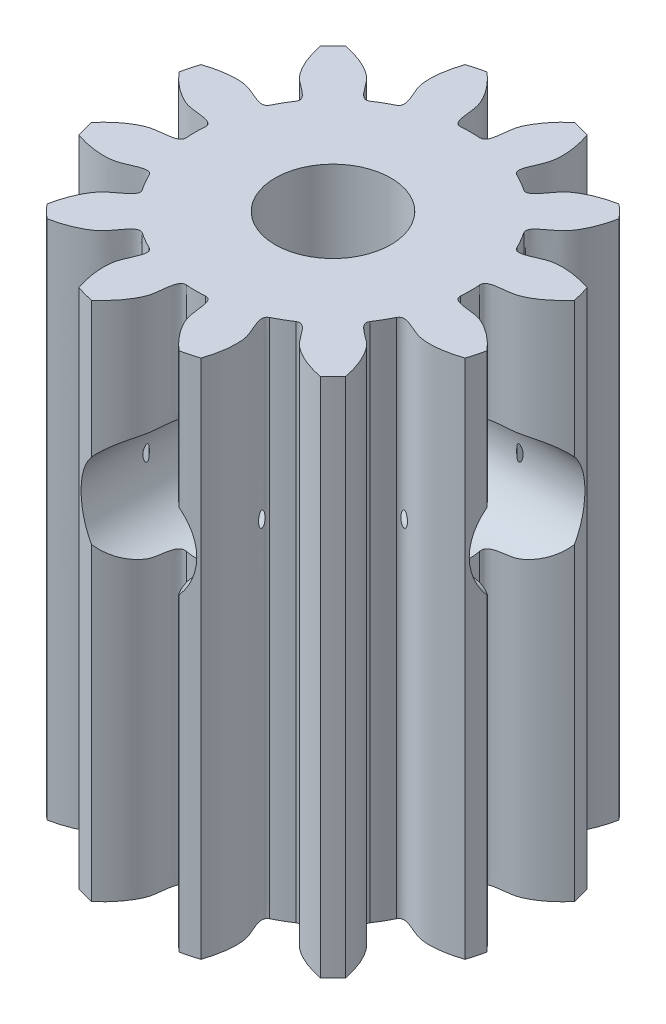
from build123d import *

# Parameters (mm, degrees)
PINION_TOOTH_BAND_18_MM_DEPTH           = 18
SHAFT_BORE_4_MM_THROUGH_SKETCH_R        = 2
SHAFT_BORE_4_MM_THROUGH_DEPTH           = 21.431317222
M4_SET_SCREW_HOLE_1_SIMPLIFIED_SKETCH_R = 2
M4_SET_SCREW_HOLE_1_SIMPLIFIED_DEPTH    = 8
M4_SET_SCREW_HOLE_2_SIMPLIFIED_SKETCH_R = 2
M4_SET_SCREW_HOLE_2_SIMPLIFIED_DEPTH    = 8


with BuildPart() as part:
    # 12T Module 1 Involute Profile → Pinion Tooth Band - 18 mm (new body)
    with BuildSketch(Plane(origin=(0, 0, 0), x_dir=(1, 0, 0), z_dir=(0, 1, 0))):
        with BuildLine():
            ThreePointArc((6.835156074, 1.510179277), (6.761480784, 1.811733316), (6.674508437, 2.109724418))
            add(Edge.make_bspline(
                [(4.26927172, 2.082262947), (4.28921203, 2.053331105), (4.328842346, 1.995830592), (4.442264933, 1.974875008), (4.561404521, 1.993783619), (4.695010451, 2.037395434), (4.836814767, 2.096319508), (4.981757663, 2.160318614), (5.123220173, 2.219161562), (5.228683275, 2.253704182), (5.29873853, 2.268577795), (5.337501067, 2.275661097), (5.381786176, 2.282324309), (5.431591999, 2.288266429), (5.486913645, 2.293141396), (5.54772681, 2.296617283), (5.613992975, 2.298358293), (5.685657797, 2.298031222), (5.762651652, 2.295304306), (5.844889548, 2.289848373), (5.932271293, 2.281337414), (6.024681452, 2.269448829), (6.121990094, 2.253865796), (6.224050512, 2.234270735), (6.330709274, 2.210374839), (6.44176677, 2.181802323), (6.557136435, 2.148557421), (6.634817322, 2.122856385), (6.674508437, 2.109724418)],
                knots=[0, 0, 0, 0, 0.040340589, 0.080174798, 0.128077722, 0.184595388, 0.246950417, 0.311283353, 0.373475922, 0.42966547, 0.443189042, 0.458849283, 0.476646191, 0.496579768, 0.518650013, 0.542856926, 0.569200507, 0.597680756, 0.628297674, 0.66105126, 0.695941513, 0.732968436, 0.772132026, 0.813432284, 0.856869211, 0.902442806, 0.950153069, 1, 1, 1, 1], degree=3))
            ThreePointArc((4.26927172, 2.082262947), (4.113620668, 2.375), (3.93792847, 2.656166291))
            add(Edge.make_bspline(
                [(3.93792847, 2.656166291), (3.922842914, 2.687901027), (3.892861167, 2.750972144), (3.931424393, 2.859676778), (4.007369524, 2.953400383), (4.111941429, 3.047300604), (4.233873332, 3.140644707), (4.361769631, 3.234169385), (4.483460374, 3.327258038), (4.566106712, 3.401320453), (4.614015266, 3.454553277), (4.639530854, 3.484580968), (4.66744392, 3.519601392), (4.697492858, 3.55976344), (4.729375526, 3.605235907), (4.762792315, 3.656163709), (4.797433156, 3.712681387), (4.832982315, 3.774908478), (4.869117664, 3.842950571), (4.905511636, 3.916898645), (4.941831802, 3.996828935), (4.977741064, 4.082802773), (5.012900083, 4.174866045), (5.046960472, 4.27305049), (5.079595399, 4.377367636), (5.110379623, 4.487832507), (5.139273525, 4.604368018), (5.155856219, 4.684492158), (5.16432916, 4.725431655)],
                knots=[0, 0, 0, 0, 0.040340589, 0.080174798, 0.128077722, 0.184595388, 0.246950417, 0.311283353, 0.373475922, 0.42966547, 0.443189042, 0.458849283, 0.476646191, 0.496579768, 0.518650013, 0.542856926, 0.569200507, 0.597680756, 0.628297674, 0.66105126, 0.695941513, 0.732968436, 0.772132026, 0.813432284, 0.856869211, 0.902442806, 0.950153069, 1, 1, 1, 1], degree=3))
            ThreePointArc((5.16432916, 4.725431655), (4.949747468, 4.949747468), (4.725431655, 5.16432916))
            add(Edge.make_bspline(
                [(2.656166291, 3.93792847), (2.687901027, 3.922842914), (2.750972144, 3.892861167), (2.859676778, 3.931424393), (2.953400383, 4.007369524), (3.047300604, 4.111941429), (3.140644707, 4.233873332), (3.234169385, 4.361769631), (3.327258038, 4.483460374), (3.401320453, 4.566106712), (3.454553277, 4.614015266), (3.484580968, 4.639530854), (3.519601392, 4.66744392), (3.55976344, 4.697492858), (3.605235907, 4.729375526), (3.656163709, 4.762792315), (3.712681387, 4.797433156), (3.774908478, 4.832982315), (3.842950571, 4.869117664), (3.916898645, 4.905511636), (3.996828935, 4.941831802), (4.082802773, 4.977741064), (4.174866045, 5.012900083), (4.27305049, 5.046960472), (4.377367636, 5.079595399), (4.487832507, 5.110379623), (4.604368018, 5.139273525), (4.684492158, 5.155856219), (4.725431655, 5.16432916)],
                knots=[0, 0, 0, 0, 0.040340589, 0.080174798, 0.128077722, 0.184595388, 0.246950417, 0.311283353, 0.373475922, 0.42966547, 0.443189042, 0.458849283, 0.476646191, 0.496579768, 0.518650013, 0.542856926, 0.569200507, 0.597680756, 0.628297674, 0.66105126, 0.695941513, 0.732968436, 0.772132026, 0.813432284, 0.856869211, 0.902442806, 0.950153069, 1, 1, 1, 1], degree=3))
            ThreePointArc((2.656166291, 3.93792847), (2.375, 4.113620668), (2.082262947, 4.26927172))
            add(Edge.make_bspline(
                [(2.082262947, 4.26927172), (2.053331105, 4.28921203), (1.995830592, 4.328842346), (1.974875008, 4.442264933), (1.993783619, 4.561404521), (2.037395434, 4.695010451), (2.096319508, 4.836814767), (2.160318614, 4.981757663), (2.219161562, 5.123220173), (2.253704182, 5.228683275), (2.268577795, 5.29873853), (2.275661097, 5.337501067), (2.282324309, 5.381786176), (2.288266429, 5.431591999), (2.293141396, 5.486913645), (2.296617283, 5.54772681), (2.298358293, 5.613992975), (2.298031222, 5.685657797), (2.295304306, 5.762651652), (2.289848373, 5.844889548), (2.281337414, 5.932271293), (2.269448829, 6.024681452), (2.253865796, 6.121990094), (2.234270735, 6.224050512), (2.210374839, 6.330709274), (2.181802323, 6.44176677), (2.148557421, 6.557136435), (2.122856385, 6.634817322), (2.109724418, 6.674508437)],
                knots=[0, 0, 0, 0, 0.040340589, 0.080174798, 0.128077722, 0.184595388, 0.246950417, 0.311283353, 0.373475922, 0.42966547, 0.443189042, 0.458849283, 0.476646191, 0.496579768, 0.518650013, 0.542856926, 0.569200507, 0.597680756, 0.628297674, 0.66105126, 0.695941513, 0.732968436, 0.772132026, 0.813432284, 0.856869211, 0.902442806, 0.950153069, 1, 1, 1, 1], degree=3))
            ThreePointArc((2.109724418, 6.674508437), (1.811733316, 6.761480784), (1.510179277, 6.835156074))
            add(Edge.make_bspline(
                [(0.33134325, 4.738429239), (0.366369115, 4.741232132), (0.435981178, 4.746802736), (0.51084054, 4.834551786), (0.554034997, 4.947184001), (0.583069022, 5.084696038), (0.602941435, 5.236964215), (0.619988031, 5.394487998), (0.639759798, 5.5464196), (0.662576563, 5.655024636), (0.684723264, 5.723131072), (0.697970213, 5.760242065), (0.714342257, 5.801925701), (0.734099142, 5.848029869), (0.757538119, 5.898377303), (0.784934495, 5.952780993), (0.816559819, 6.01103968), (0.852675481, 6.0729397), (0.893533988, 6.138254877), (0.939377913, 6.206747018), (0.990439492, 6.278166349), (1.046940388, 6.352251602), (1.109090011, 6.428731841), (1.17709004, 6.507321225), (1.251113875, 6.587742475), (1.331387147, 6.669634829), (1.41786291, 6.752925439), (1.478961103, 6.807348543), (1.510179277, 6.835156074)],
                knots=[0, 0, 0, 0, 0.040340589, 0.080174798, 0.128077722, 0.184595388, 0.246950417, 0.311283353, 0.373475922, 0.42966547, 0.443189042, 0.458849283, 0.476646191, 0.496579768, 0.518650013, 0.542856926, 0.569200507, 0.597680756, 0.628297674, 0.66105126, 0.695941513, 0.732968436, 0.772132026, 0.813432284, 0.856869211, 0.902442806, 0.950153069, 1, 1, 1, 1], degree=3))
            ThreePointArc((0.33134325, 4.738429239), (0, 4.75), (-0.33134325, 4.738429239))
            add(Edge.make_bspline(
                [(-0.33134325, 4.738429239), (-0.366369115, 4.741232132), (-0.435981178, 4.746802736), (-0.51084054, 4.834551786), (-0.554034997, 4.947184001), (-0.583069022, 5.084696038), (-0.602941435, 5.236964215), (-0.619988031, 5.394487998), (-0.639759798, 5.5464196), (-0.662576563, 5.655024636), (-0.684723264, 5.723131072), (-0.697970213, 5.760242065), (-0.714342257, 5.801925701), (-0.734099142, 5.848029869), (-0.757538119, 5.898377303), (-0.784934495, 5.952780993), (-0.816559819, 6.01103968), (-0.852675481, 6.0729397), (-0.893533988, 6.138254877), (-0.939377913, 6.206747018), (-0.990439492, 6.278166349), (-1.046940388, 6.352251602), (-1.109090011, 6.428731841), (-1.17709004, 6.507321225), (-1.251113875, 6.587742475), (-1.331387147, 6.669634829), (-1.41786291, 6.752925439), (-1.478961103, 6.807348543), (-1.510179277, 6.835156074)],
                knots=[0, 0, 0, 0, 0.040340589, 0.080174798, 0.128077722, 0.184595388, 0.246950417, 0.311283353, 0.373475922, 0.42966547, 0.443189042, 0.458849283, 0.476646191, 0.496579768, 0.518650013, 0.542856926, 0.569200507, 0.597680756, 0.628297674, 0.66105126, 0.695941513, 0.732968436, 0.772132026, 0.813432284, 0.856869211, 0.902442806, 0.950153069, 1, 1, 1, 1], degree=3))
            ThreePointArc((-1.510179277, 6.835156074), (-1.811733316, 6.761480784), (-2.109724418, 6.674508437))
            add(Edge.make_bspline(
                [(-2.082262947, 4.26927172), (-2.053331105, 4.28921203), (-1.995830592, 4.328842346), (-1.974875008, 4.442264933), (-1.993783619, 4.561404521), (-2.037395434, 4.695010451), (-2.096319508, 4.836814767), (-2.160318614, 4.981757663), (-2.219161562, 5.123220173), (-2.253704182, 5.228683275), (-2.268577795, 5.29873853), (-2.275661097, 5.337501067), (-2.282324309, 5.381786176), (-2.288266429, 5.431591999), (-2.293141396, 5.486913645), (-2.296617283, 5.54772681), (-2.298358293, 5.613992975), (-2.298031222, 5.685657797), (-2.295304306, 5.762651652), (-2.289848373, 5.844889548), (-2.281337414, 5.932271293), (-2.269448829, 6.024681452), (-2.253865796, 6.121990094), (-2.234270735, 6.224050512), (-2.210374839, 6.330709274), (-2.181802323, 6.44176677), (-2.148557421, 6.557136435), (-2.122856385, 6.634817322), (-2.109724418, 6.674508437)],
                knots=[0, 0, 0, 0, 0.040340589, 0.080174798, 0.128077722, 0.184595388, 0.246950417, 0.311283353, 0.373475922, 0.42966547, 0.443189042, 0.458849283, 0.476646191, 0.496579768, 0.518650013, 0.542856926, 0.569200507, 0.597680756, 0.628297674, 0.66105126, 0.695941513, 0.732968436, 0.772132026, 0.813432284, 0.856869211, 0.902442806, 0.950153069, 1, 1, 1, 1], degree=3))
            ThreePointArc((-2.082262947, 4.26927172), (-2.375, 4.113620668), (-2.656166291, 3.93792847))
            add(Edge.make_bspline(
                [(-2.656166291, 3.93792847), (-2.687901027, 3.922842914), (-2.750972144, 3.892861167), (-2.859676778, 3.931424393), (-2.953400383, 4.007369524), (-3.047300604, 4.111941429), (-3.140644707, 4.233873332), (-3.234169385, 4.361769631), (-3.327258038, 4.483460374), (-3.401320453, 4.566106712), (-3.454553277, 4.614015266), (-3.484580968, 4.639530854), (-3.519601392, 4.66744392), (-3.55976344, 4.697492858), (-3.605235907, 4.729375526), (-3.656163709, 4.762792315), (-3.712681387, 4.797433156), (-3.774908478, 4.832982315), (-3.842950571, 4.869117664), (-3.916898645, 4.905511636), (-3.996828935, 4.941831802), (-4.082802773, 4.977741064), (-4.174866045, 5.012900083), (-4.27305049, 5.046960472), (-4.377367636, 5.079595399), (-4.487832507, 5.110379623), (-4.604368018, 5.139273525), (-4.684492158, 5.155856219), (-4.725431655, 5.16432916)],
                knots=[0, 0, 0, 0, 0.040340589, 0.080174798, 0.128077722, 0.184595388, 0.246950417, 0.311283353, 0.373475922, 0.42966547, 0.443189042, 0.458849283, 0.476646191, 0.496579768, 0.518650013, 0.542856926, 0.569200507, 0.597680756, 0.628297674, 0.66105126, 0.695941513, 0.732968436, 0.772132026, 0.813432284, 0.856869211, 0.902442806, 0.950153069, 1, 1, 1, 1], degree=3))
            ThreePointArc((-4.725431655, 5.16432916), (-4.949747468, 4.949747468), (-5.16432916, 4.725431655))
            add(Edge.make_bspline(
                [(-3.93792847, 2.656166291), (-3.922842914, 2.687901027), (-3.892861167, 2.750972144), (-3.931424393, 2.859676778), (-4.007369524, 2.953400383), (-4.111941429, 3.047300604), (-4.233873332, 3.140644707), (-4.361769631, 3.234169385), (-4.483460374, 3.327258038), (-4.566106712, 3.401320453), (-4.614015266, 3.454553277), (-4.639530854, 3.484580968), (-4.66744392, 3.519601392), (-4.697492858, 3.55976344), (-4.729375526, 3.605235907), (-4.762792315, 3.656163709), (-4.797433156, 3.712681387), (-4.832982315, 3.774908478), (-4.869117664, 3.842950571), (-4.905511636, 3.916898645), (-4.941831802, 3.996828935), (-4.977741064, 4.082802773), (-5.012900083, 4.174866045), (-5.046960472, 4.27305049), (-5.079595399, 4.377367636), (-5.110379623, 4.487832507), (-5.139273525, 4.604368018), (-5.155856219, 4.684492158), (-5.16432916, 4.725431655)],
                knots=[0, 0, 0, 0, 0.040340589, 0.080174798, 0.128077722, 0.184595388, 0.246950417, 0.311283353, 0.373475922, 0.42966547, 0.443189042, 0.458849283, 0.476646191, 0.496579768, 0.518650013, 0.542856926, 0.569200507, 0.597680756, 0.628297674, 0.66105126, 0.695941513, 0.732968436, 0.772132026, 0.813432284, 0.856869211, 0.902442806, 0.950153069, 1, 1, 1, 1], degree=3))
            ThreePointArc((-3.93792847, 2.656166291), (-4.113620668, 2.375), (-4.26927172, 2.082262947))
            add(Edge.make_bspline(
                [(-4.26927172, 2.082262947), (-4.28921203, 2.053331105), (-4.328842346, 1.995830592), (-4.442264933, 1.974875008), (-4.561404521, 1.993783619), (-4.695010451, 2.037395434), (-4.836814767, 2.096319508), (-4.981757663, 2.160318614), (-5.123220173, 2.219161562), (-5.228683275, 2.253704182), (-5.29873853, 2.268577795), (-5.337501067, 2.275661097), (-5.381786176, 2.282324309), (-5.431591999, 2.288266429), (-5.486913645, 2.293141396), (-5.54772681, 2.296617283), (-5.613992975, 2.298358293), (-5.685657797, 2.298031222), (-5.762651652, 2.295304306), (-5.844889548, 2.289848373), (-5.932271293, 2.281337414), (-6.024681452, 2.269448829), (-6.121990094, 2.253865796), (-6.224050512, 2.234270735), (-6.330709274, 2.210374839), (-6.44176677, 2.181802323), (-6.557136435, 2.148557421), (-6.634817322, 2.122856385), (-6.674508437, 2.109724418)],
                knots=[0, 0, 0, 0, 0.040340589, 0.080174798, 0.128077722, 0.184595388, 0.246950417, 0.311283353, 0.373475922, 0.42966547, 0.443189042, 0.458849283, 0.476646191, 0.496579768, 0.518650013, 0.542856926, 0.569200507, 0.597680756, 0.628297674, 0.66105126, 0.695941513, 0.732968436, 0.772132026, 0.813432284, 0.856869211, 0.902442806, 0.950153069, 1, 1, 1, 1], degree=3))
            ThreePointArc((-6.674508437, 2.109724418), (-6.761480784, 1.811733316), (-6.835156074, 1.510179277))
            add(Edge.make_bspline(
                [(-4.738429239, 0.33134325), (-4.741232132, 0.366369115), (-4.746802736, 0.435981178), (-4.834551786, 0.51084054), (-4.947184001, 0.554034997), (-5.084696038, 0.583069022), (-5.236964215, 0.602941435), (-5.394487998, 0.619988031), (-5.5464196, 0.639759798), (-5.655024636, 0.662576563), (-5.723131072, 0.684723264), (-5.760242065, 0.697970213), (-5.801925701, 0.714342257), (-5.848029869, 0.734099142), (-5.898377303, 0.757538119), (-5.952780993, 0.784934495), (-6.01103968, 0.816559819), (-6.0729397, 0.852675481), (-6.138254877, 0.893533988), (-6.206747018, 0.939377913), (-6.278166349, 0.990439492), (-6.352251602, 1.046940388), (-6.428731841, 1.109090011), (-6.507321225, 1.17709004), (-6.587742475, 1.251113875), (-6.669634829, 1.331387147), (-6.752925439, 1.41786291), (-6.807348543, 1.478961103), (-6.835156074, 1.510179277)],
                knots=[0, 0, 0, 0, 0.040340589, 0.080174798, 0.128077722, 0.184595388, 0.246950417, 0.311283353, 0.373475922, 0.42966547, 0.443189042, 0.458849283, 0.476646191, 0.496579768, 0.518650013, 0.542856926, 0.569200507, 0.597680756, 0.628297674, 0.66105126, 0.695941513, 0.732968436, 0.772132026, 0.813432284, 0.856869211, 0.902442806, 0.950153069, 1, 1, 1, 1], degree=3))
            ThreePointArc((-4.738429239, 0.33134325), (-4.75, 0), (-4.738429239, -0.33134325))
            add(Edge.make_bspline(
                [(-4.738429239, -0.33134325), (-4.741232132, -0.366369115), (-4.746802736, -0.435981178), (-4.834551786, -0.51084054), (-4.947184001, -0.554034997), (-5.084696038, -0.583069022), (-5.236964215, -0.602941435), (-5.394487998, -0.619988031), (-5.5464196, -0.639759798), (-5.655024636, -0.662576563), (-5.723131072, -0.684723264), (-5.760242065, -0.697970213), (-5.801925701, -0.714342257), (-5.848029869, -0.734099142), (-5.898377303, -0.757538119), (-5.952780993, -0.784934495), (-6.01103968, -0.816559819), (-6.0729397, -0.852675481), (-6.138254877, -0.893533988), (-6.206747018, -0.939377913), (-6.278166349, -0.990439492), (-6.352251602, -1.046940388), (-6.428731841, -1.109090011), (-6.507321225, -1.17709004), (-6.587742475, -1.251113875), (-6.669634829, -1.331387147), (-6.752925439, -1.41786291), (-6.807348543, -1.478961103), (-6.835156074, -1.510179277)],
                knots=[0, 0, 0, 0, 0.040340589, 0.080174798, 0.128077722, 0.184595388, 0.246950417, 0.311283353, 0.373475922, 0.42966547, 0.443189042, 0.458849283, 0.476646191, 0.496579768, 0.518650013, 0.542856926, 0.569200507, 0.597680756, 0.628297674, 0.66105126, 0.695941513, 0.732968436, 0.772132026, 0.813432284, 0.856869211, 0.902442806, 0.950153069, 1, 1, 1, 1], degree=3))
            ThreePointArc((-6.835156074, -1.510179277), (-6.761480784, -1.811733316), (-6.674508437, -2.109724418))
            add(Edge.make_bspline(
                [(-4.26927172, -2.082262947), (-4.28921203, -2.053331105), (-4.328842346, -1.995830592), (-4.442264933, -1.974875008), (-4.561404521, -1.993783619), (-4.695010451, -2.037395434), (-4.836814767, -2.096319508), (-4.981757663, -2.160318614), (-5.123220173, -2.219161562), (-5.228683275, -2.253704182), (-5.29873853, -2.268577795), (-5.337501067, -2.275661097), (-5.381786176, -2.282324309), (-5.431591999, -2.288266429), (-5.486913645, -2.293141396), (-5.54772681, -2.296617283), (-5.613992975, -2.298358293), (-5.685657797, -2.298031222), (-5.762651652, -2.295304306), (-5.844889548, -2.289848373), (-5.932271293, -2.281337414), (-6.024681452, -2.269448829), (-6.121990094, -2.253865796), (-6.224050512, -2.234270735), (-6.330709274, -2.210374839), (-6.44176677, -2.181802323), (-6.557136435, -2.148557421), (-6.634817322, -2.122856385), (-6.674508437, -2.109724418)],
                knots=[0, 0, 0, 0, 0.040340589, 0.080174798, 0.128077722, 0.184595388, 0.246950417, 0.311283353, 0.373475922, 0.42966547, 0.443189042, 0.458849283, 0.476646191, 0.496579768, 0.518650013, 0.542856926, 0.569200507, 0.597680756, 0.628297674, 0.66105126, 0.695941513, 0.732968436, 0.772132026, 0.813432284, 0.856869211, 0.902442806, 0.950153069, 1, 1, 1, 1], degree=3))
            ThreePointArc((-4.26927172, -2.082262947), (-4.113620668, -2.375), (-3.93792847, -2.656166291))
            add(Edge.make_bspline(
                [(-3.93792847, -2.656166291), (-3.922842914, -2.687901027), (-3.892861167, -2.750972144), (-3.931424393, -2.859676778), (-4.007369524, -2.953400383), (-4.111941429, -3.047300604), (-4.233873332, -3.140644707), (-4.361769631, -3.234169385), (-4.483460374, -3.327258038), (-4.566106712, -3.401320453), (-4.614015266, -3.454553277), (-4.639530854, -3.484580968), (-4.66744392, -3.519601392), (-4.697492858, -3.55976344), (-4.729375526, -3.605235907), (-4.762792315, -3.656163709), (-4.797433156, -3.712681387), (-4.832982315, -3.774908478), (-4.869117664, -3.842950571), (-4.905511636, -3.916898645), (-4.941831802, -3.996828935), (-4.977741064, -4.082802773), (-5.012900083, -4.174866045), (-5.046960472, -4.27305049), (-5.079595399, -4.377367636), (-5.110379623, -4.487832507), (-5.139273525, -4.604368018), (-5.155856219, -4.684492158), (-5.16432916, -4.725431655)],
                knots=[0, 0, 0, 0, 0.040340589, 0.080174798, 0.128077722, 0.184595388, 0.246950417, 0.311283353, 0.373475922, 0.42966547, 0.443189042, 0.458849283, 0.476646191, 0.496579768, 0.518650013, 0.542856926, 0.569200507, 0.597680756, 0.628297674, 0.66105126, 0.695941513, 0.732968436, 0.772132026, 0.813432284, 0.856869211, 0.902442806, 0.950153069, 1, 1, 1, 1], degree=3))
            ThreePointArc((-5.16432916, -4.725431655), (-4.949747468, -4.949747468), (-4.725431655, -5.16432916))
            add(Edge.make_bspline(
                [(-2.656166291, -3.93792847), (-2.687901027, -3.922842914), (-2.750972144, -3.892861167), (-2.859676778, -3.931424393), (-2.953400383, -4.007369524), (-3.047300604, -4.111941429), (-3.140644707, -4.233873332), (-3.234169385, -4.361769631), (-3.327258038, -4.483460374), (-3.401320453, -4.566106712), (-3.454553277, -4.614015266), (-3.484580968, -4.639530854), (-3.519601392, -4.66744392), (-3.55976344, -4.697492858), (-3.605235907, -4.729375526), (-3.656163709, -4.762792315), (-3.712681387, -4.797433156), (-3.774908478, -4.832982315), (-3.842950571, -4.869117664), (-3.916898645, -4.905511636), (-3.996828935, -4.941831802), (-4.082802773, -4.977741064), (-4.174866045, -5.012900083), (-4.27305049, -5.046960472), (-4.377367636, -5.079595399), (-4.487832507, -5.110379623), (-4.604368018, -5.139273525), (-4.684492158, -5.155856219), (-4.725431655, -5.16432916)],
                knots=[0, 0, 0, 0, 0.040340589, 0.080174798, 0.128077722, 0.184595388, 0.246950417, 0.311283353, 0.373475922, 0.42966547, 0.443189042, 0.458849283, 0.476646191, 0.496579768, 0.518650013, 0.542856926, 0.569200507, 0.597680756, 0.628297674, 0.66105126, 0.695941513, 0.732968436, 0.772132026, 0.813432284, 0.856869211, 0.902442806, 0.950153069, 1, 1, 1, 1], degree=3))
            ThreePointArc((-2.656166291, -3.93792847), (-2.375, -4.113620668), (-2.082262947, -4.26927172))
            add(Edge.make_bspline(
                [(-2.082262947, -4.26927172), (-2.053331105, -4.28921203), (-1.995830592, -4.328842346), (-1.974875008, -4.442264933), (-1.993783619, -4.561404521), (-2.037395434, -4.695010451), (-2.096319508, -4.836814767), (-2.160318614, -4.981757663), (-2.219161562, -5.123220173), (-2.253704182, -5.228683275), (-2.268577795, -5.29873853), (-2.275661097, -5.337501067), (-2.282324309, -5.381786176), (-2.288266429, -5.431591999), (-2.293141396, -5.486913645), (-2.296617283, -5.54772681), (-2.298358293, -5.613992975), (-2.298031222, -5.685657797), (-2.295304306, -5.762651652), (-2.289848373, -5.844889548), (-2.281337414, -5.932271293), (-2.269448829, -6.024681452), (-2.253865796, -6.121990094), (-2.234270735, -6.224050512), (-2.210374839, -6.330709274), (-2.181802323, -6.44176677), (-2.148557421, -6.557136435), (-2.122856385, -6.634817322), (-2.109724418, -6.674508437)],
                knots=[0, 0, 0, 0, 0.040340589, 0.080174798, 0.128077722, 0.184595388, 0.246950417, 0.311283353, 0.373475922, 0.42966547, 0.443189042, 0.458849283, 0.476646191, 0.496579768, 0.518650013, 0.542856926, 0.569200507, 0.597680756, 0.628297674, 0.66105126, 0.695941513, 0.732968436, 0.772132026, 0.813432284, 0.856869211, 0.902442806, 0.950153069, 1, 1, 1, 1], degree=3))
            ThreePointArc((-2.109724418, -6.674508437), (-1.811733316, -6.761480784), (-1.510179277, -6.835156074))
            add(Edge.make_bspline(
                [(-0.33134325, -4.738429239), (-0.366369115, -4.741232132), (-0.435981178, -4.746802736), (-0.51084054, -4.834551786), (-0.554034997, -4.947184001), (-0.583069022, -5.084696038), (-0.602941435, -5.236964215), (-0.619988031, -5.394487998), (-0.639759798, -5.5464196), (-0.662576563, -5.655024636), (-0.684723264, -5.723131072), (-0.697970213, -5.760242065), (-0.714342257, -5.801925701), (-0.734099142, -5.848029869), (-0.757538119, -5.898377303), (-0.784934495, -5.952780993), (-0.816559819, -6.01103968), (-0.852675481, -6.0729397), (-0.893533988, -6.138254877), (-0.939377913, -6.206747018), (-0.990439492, -6.278166349), (-1.046940388, -6.352251602), (-1.109090011, -6.428731841), (-1.17709004, -6.507321225), (-1.251113875, -6.587742475), (-1.331387147, -6.669634829), (-1.41786291, -6.752925439), (-1.478961103, -6.807348543), (-1.510179277, -6.835156074)],
                knots=[0, 0, 0, 0, 0.040340589, 0.080174798, 0.128077722, 0.184595388, 0.246950417, 0.311283353, 0.373475922, 0.42966547, 0.443189042, 0.458849283, 0.476646191, 0.496579768, 0.518650013, 0.542856926, 0.569200507, 0.597680756, 0.628297674, 0.66105126, 0.695941513, 0.732968436, 0.772132026, 0.813432284, 0.856869211, 0.902442806, 0.950153069, 1, 1, 1, 1], degree=3))
            ThreePointArc((-0.33134325, -4.738429239), (0, -4.75), (0.33134325, -4.738429239))
            add(Edge.make_bspline(
                [(0.33134325, -4.738429239), (0.366369115, -4.741232132), (0.435981178, -4.746802736), (0.51084054, -4.834551786), (0.554034997, -4.947184001), (0.583069022, -5.084696038), (0.602941435, -5.236964215), (0.619988031, -5.394487998), (0.639759798, -5.5464196), (0.662576563, -5.655024636), (0.684723264, -5.723131072), (0.697970213, -5.760242065), (0.714342257, -5.801925701), (0.734099142, -5.848029869), (0.757538119, -5.898377303), (0.784934495, -5.952780993), (0.816559819, -6.01103968), (0.852675481, -6.0729397), (0.893533988, -6.138254877), (0.939377913, -6.206747018), (0.990439492, -6.278166349), (1.046940388, -6.352251602), (1.109090011, -6.428731841), (1.17709004, -6.507321225), (1.251113875, -6.587742475), (1.331387147, -6.669634829), (1.41786291, -6.752925439), (1.478961103, -6.807348543), (1.510179277, -6.835156074)],
                knots=[0, 0, 0, 0, 0.040340589, 0.080174798, 0.128077722, 0.184595388, 0.246950417, 0.311283353, 0.373475922, 0.42966547, 0.443189042, 0.458849283, 0.476646191, 0.496579768, 0.518650013, 0.542856926, 0.569200507, 0.597680756, 0.628297674, 0.66105126, 0.695941513, 0.732968436, 0.772132026, 0.813432284, 0.856869211, 0.902442806, 0.950153069, 1, 1, 1, 1], degree=3))
            ThreePointArc((1.510179277, -6.835156074), (1.811733316, -6.761480784), (2.109724418, -6.674508437))
            add(Edge.make_bspline(
                [(2.082262947, -4.26927172), (2.053331105, -4.28921203), (1.995830592, -4.328842346), (1.974875008, -4.442264933), (1.993783619, -4.561404521), (2.037395434, -4.695010451), (2.096319508, -4.836814767), (2.160318614, -4.981757663), (2.219161562, -5.123220173), (2.253704182, -5.228683275), (2.268577795, -5.29873853), (2.275661097, -5.337501067), (2.282324309, -5.381786176), (2.288266429, -5.431591999), (2.293141396, -5.486913645), (2.296617283, -5.54772681), (2.298358293, -5.613992975), (2.298031222, -5.685657797), (2.295304306, -5.762651652), (2.289848373, -5.844889548), (2.281337414, -5.932271293), (2.269448829, -6.024681452), (2.253865796, -6.121990094), (2.234270735, -6.224050512), (2.210374839, -6.330709274), (2.181802323, -6.44176677), (2.148557421, -6.557136435), (2.122856385, -6.634817322), (2.109724418, -6.674508437)],
                knots=[0, 0, 0, 0, 0.040340589, 0.080174798, 0.128077722, 0.184595388, 0.246950417, 0.311283353, 0.373475922, 0.42966547, 0.443189042, 0.458849283, 0.476646191, 0.496579768, 0.518650013, 0.542856926, 0.569200507, 0.597680756, 0.628297674, 0.66105126, 0.695941513, 0.732968436, 0.772132026, 0.813432284, 0.856869211, 0.902442806, 0.950153069, 1, 1, 1, 1], degree=3))
            ThreePointArc((2.082262947, -4.26927172), (2.375, -4.113620668), (2.656166291, -3.93792847))
            add(Edge.make_bspline(
                [(2.656166291, -3.93792847), (2.687901027, -3.922842914), (2.750972144, -3.892861167), (2.859676778, -3.931424393), (2.953400383, -4.007369524), (3.047300604, -4.111941429), (3.140644707, -4.233873332), (3.234169385, -4.361769631), (3.327258038, -4.483460374), (3.401320453, -4.566106712), (3.454553277, -4.614015266), (3.484580968, -4.639530854), (3.519601392, -4.66744392), (3.55976344, -4.697492858), (3.605235907, -4.729375526), (3.656163709, -4.762792315), (3.712681387, -4.797433156), (3.774908478, -4.832982315), (3.842950571, -4.869117664), (3.916898645, -4.905511636), (3.996828935, -4.941831802), (4.082802773, -4.977741064), (4.174866045, -5.012900083), (4.27305049, -5.046960472), (4.377367636, -5.079595399), (4.487832507, -5.110379623), (4.604368018, -5.139273525), (4.684492158, -5.155856219), (4.725431655, -5.16432916)],
                knots=[0, 0, 0, 0, 0.040340589, 0.080174798, 0.128077722, 0.184595388, 0.246950417, 0.311283353, 0.373475922, 0.42966547, 0.443189042, 0.458849283, 0.476646191, 0.496579768, 0.518650013, 0.542856926, 0.569200507, 0.597680756, 0.628297674, 0.66105126, 0.695941513, 0.732968436, 0.772132026, 0.813432284, 0.856869211, 0.902442806, 0.950153069, 1, 1, 1, 1], degree=3))
            ThreePointArc((4.725431655, -5.16432916), (4.949747468, -4.949747468), (5.16432916, -4.725431655))
            add(Edge.make_bspline(
                [(3.93792847, -2.656166291), (3.922842914, -2.687901027), (3.892861167, -2.750972144), (3.931424393, -2.859676778), (4.007369524, -2.953400383), (4.111941429, -3.047300604), (4.233873332, -3.140644707), (4.361769631, -3.234169385), (4.483460374, -3.327258038), (4.566106712, -3.401320453), (4.614015266, -3.454553277), (4.639530854, -3.484580968), (4.66744392, -3.519601392), (4.697492858, -3.55976344), (4.729375526, -3.605235907), (4.762792315, -3.656163709), (4.797433156, -3.712681387), (4.832982315, -3.774908478), (4.869117664, -3.842950571), (4.905511636, -3.916898645), (4.941831802, -3.996828935), (4.977741064, -4.082802773), (5.012900083, -4.174866045), (5.046960472, -4.27305049), (5.079595399, -4.377367636), (5.110379623, -4.487832507), (5.139273525, -4.604368018), (5.155856219, -4.684492158), (5.16432916, -4.725431655)],
                knots=[0, 0, 0, 0, 0.040340589, 0.080174798, 0.128077722, 0.184595388, 0.246950417, 0.311283353, 0.373475922, 0.42966547, 0.443189042, 0.458849283, 0.476646191, 0.496579768, 0.518650013, 0.542856926, 0.569200507, 0.597680756, 0.628297674, 0.66105126, 0.695941513, 0.732968436, 0.772132026, 0.813432284, 0.856869211, 0.902442806, 0.950153069, 1, 1, 1, 1], degree=3))
            ThreePointArc((3.93792847, -2.656166291), (4.113620668, -2.375), (4.26927172, -2.082262947))
            add(Edge.make_bspline(
                [(4.26927172, -2.082262947), (4.28921203, -2.053331105), (4.328842346, -1.995830592), (4.442264933, -1.974875008), (4.561404521, -1.993783619), (4.695010451, -2.037395434), (4.836814767, -2.096319508), (4.981757663, -2.160318614), (5.123220173, -2.219161562), (5.228683275, -2.253704182), (5.29873853, -2.268577795), (5.337501067, -2.275661097), (5.381786176, -2.282324309), (5.431591999, -2.288266429), (5.486913645, -2.293141396), (5.54772681, -2.296617283), (5.613992975, -2.298358293), (5.685657797, -2.298031222), (5.762651652, -2.295304306), (5.844889548, -2.289848373), (5.932271293, -2.281337414), (6.024681452, -2.269448829), (6.121990094, -2.253865796), (6.224050512, -2.234270735), (6.330709274, -2.210374839), (6.44176677, -2.181802323), (6.557136435, -2.148557421), (6.634817322, -2.122856385), (6.674508437, -2.109724418)],
                knots=[0, 0, 0, 0, 0.040340589, 0.080174798, 0.128077722, 0.184595388, 0.246950417, 0.311283353, 0.373475922, 0.42966547, 0.443189042, 0.458849283, 0.476646191, 0.496579768, 0.518650013, 0.542856926, 0.569200507, 0.597680756, 0.628297674, 0.66105126, 0.695941513, 0.732968436, 0.772132026, 0.813432284, 0.856869211, 0.902442806, 0.950153069, 1, 1, 1, 1], degree=3))
            ThreePointArc((6.674508437, -2.109724418), (6.761480784, -1.811733316), (6.835156074, -1.510179277))
            add(Edge.make_bspline(
                [(4.738429239, -0.33134325), (4.741232132, -0.366369115), (4.746802736, -0.435981178), (4.834551786, -0.51084054), (4.947184001, -0.554034997), (5.084696038, -0.583069022), (5.236964215, -0.602941435), (5.394487998, -0.619988031), (5.5464196, -0.639759798), (5.655024636, -0.662576563), (5.723131072, -0.684723264), (5.760242065, -0.697970213), (5.801925701, -0.714342257), (5.848029869, -0.734099142), (5.898377303, -0.757538119), (5.952780993, -0.784934495), (6.01103968, -0.816559819), (6.0729397, -0.852675481), (6.138254877, -0.893533988), (6.206747018, -0.939377913), (6.278166349, -0.990439492), (6.352251602, -1.046940388), (6.428731841, -1.109090011), (6.507321225, -1.17709004), (6.587742475, -1.251113875), (6.669634829, -1.331387147), (6.752925439, -1.41786291), (6.807348543, -1.478961103), (6.835156074, -1.510179277)],
                knots=[0, 0, 0, 0, 0.040340589, 0.080174798, 0.128077722, 0.184595388, 0.246950417, 0.311283353, 0.373475922, 0.42966547, 0.443189042, 0.458849283, 0.476646191, 0.496579768, 0.518650013, 0.542856926, 0.569200507, 0.597680756, 0.628297674, 0.66105126, 0.695941513, 0.732968436, 0.772132026, 0.813432284, 0.856869211, 0.902442806, 0.950153069, 1, 1, 1, 1], degree=3))
            ThreePointArc((4.738429239, -0.33134325), (4.75, 0), (4.738429239, 0.33134325))
            add(Edge.make_bspline(
                [(4.738429239, 0.33134325), (4.741232132, 0.366369115), (4.746802736, 0.435981178), (4.834551786, 0.51084054), (4.947184001, 0.554034997), (5.084696038, 0.583069022), (5.236964215, 0.602941435), (5.394487998, 0.619988031), (5.5464196, 0.639759798), (5.655024636, 0.662576563), (5.723131072, 0.684723264), (5.760242065, 0.697970213), (5.801925701, 0.714342257), (5.848029869, 0.734099142), (5.898377303, 0.757538119), (5.952780993, 0.784934495), (6.01103968, 0.816559819), (6.0729397, 0.852675481), (6.138254877, 0.893533988), (6.206747018, 0.939377913), (6.278166349, 0.990439492), (6.352251602, 1.046940388), (6.428731841, 1.109090011), (6.507321225, 1.17709004), (6.587742475, 1.251113875), (6.669634829, 1.331387147), (6.752925439, 1.41786291), (6.807348543, 1.478961103), (6.835156074, 1.510179277)],
                knots=[0, 0, 0, 0, 0.040340589, 0.080174798, 0.128077722, 0.184595388, 0.246950417, 0.311283353, 0.373475922, 0.42966547, 0.443189042, 0.458849283, 0.476646191, 0.496579768, 0.518650013, 0.542856926, 0.569200507, 0.597680756, 0.628297674, 0.66105126, 0.695941513, 0.732968436, 0.772132026, 0.813432284, 0.856869211, 0.902442806, 0.950153069, 1, 1, 1, 1], degree=3))
        make_face()
    extrude(amount=PINION_TOOTH_BAND_18_MM_DEPTH)

    # Shaft Bore - 4 mm Through Sketch → Shaft Bore - 4 mm Through (cut, through all)
    with BuildSketch(Plane(origin=(0, 0, 0), x_dir=(1, 0, 0), z_dir=(0, 1, 0))):
        with Locations(Location((0, 0, 0), (0, 0, 270))):
            Circle(SHAFT_BORE_4_MM_THROUGH_SKETCH_R)
    extrude(amount=SHAFT_BORE_4_MM_THROUGH_DEPTH, mode=Mode.SUBTRACT)

    # M4 Set Screw Hole 1 - Simplified Sketch → M4 Set Screw Hole 1 - Simplified (cut)
    with BuildSketch(Plane(origin=(0, 0, 0), x_dir=(0, 0, -1), z_dir=(1, 0, 0))):
        with Locations(Location((0, 12, 0), (0, 0, 180))):
            Circle(M4_SET_SCREW_HOLE_1_SIMPLIFIED_SKETCH_R)
    extrude(amount=M4_SET_SCREW_HOLE_1_SIMPLIFIED_DEPTH, mode=Mode.SUBTRACT)

    # M4 Set Screw Hole 2 - Simplified Sketch → M4 Set Screw Hole 2 - Simplified (cut)
    with BuildSketch(Plane.XY):
        with Locations(Location((0, 12, 0), (0, 0, 319.033202813))):
            Circle(M4_SET_SCREW_HOLE_2_SIMPLIFIED_SKETCH_R)
    extrude(amount=M4_SET_SCREW_HOLE_2_SIMPLIFIED_DEPTH, mode=Mode.SUBTRACT)


solid = part.part
